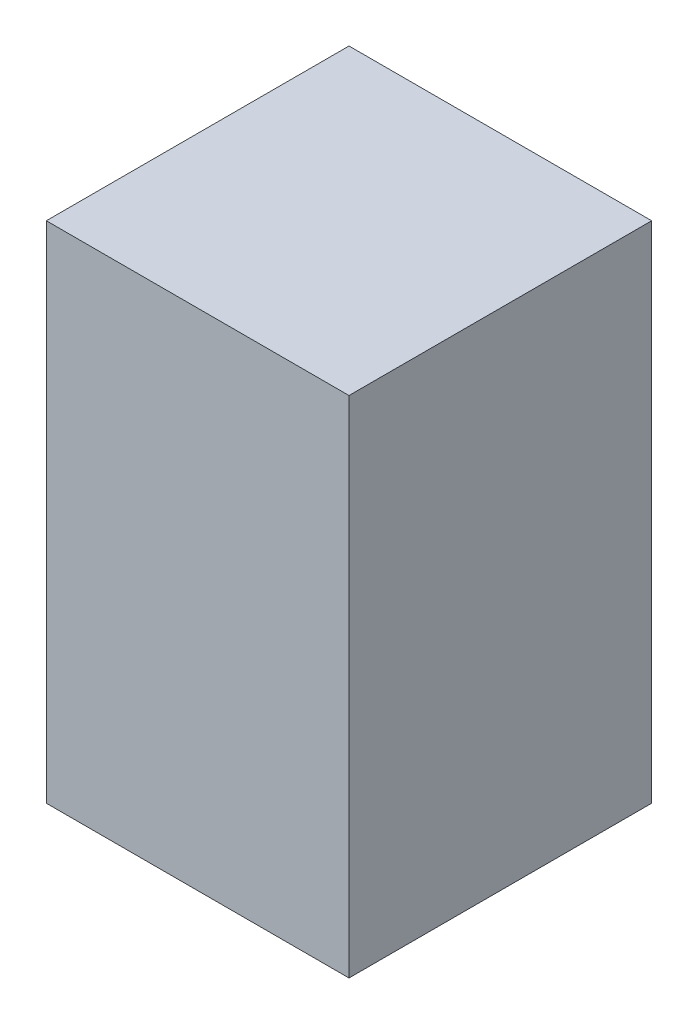
from build123d import *

# Parameters (mm, degrees)
SKETCH1_W           = 60
SKETCH1_H           = 100
BOSS_EXTRUDE1_DEPTH = 30


with BuildPart() as part:
    # Sketch1 → Boss-Extrude1 (new, symmetric)
    with BuildSketch(Plane.XY):
        Rectangle(SKETCH1_W, SKETCH1_H)
    extrude(amount=BOSS_EXTRUDE1_DEPTH, both=True)


solid = part.part
